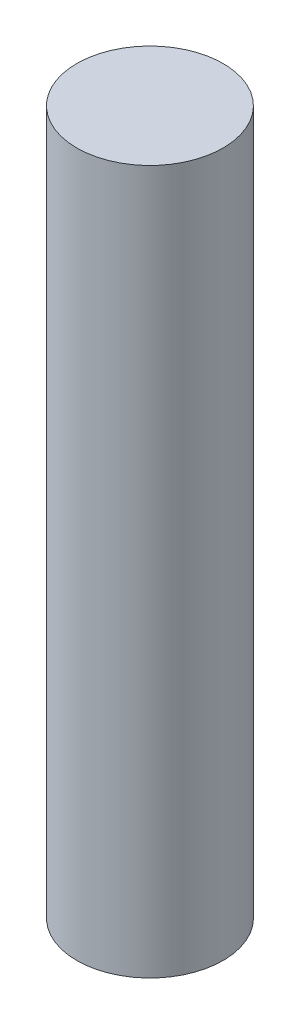
from build123d import *

# Parameters (mm, degrees)
SKETCH1_R           = 2.6
BOSS_EXTRUDE1_DEPTH = 25


with BuildPart() as part:
    # Sketch1 → Boss-Extrude1 (new body)
    with BuildSketch(Plane(origin=(0, 0, 0), x_dir=(1, 0, 0), z_dir=(0, 1, 0))):
        with Locations(Location((0, 0, 0), (0, 0, 270))):
            Circle(SKETCH1_R)
    extrude(amount=BOSS_EXTRUDE1_DEPTH)


solid = part.part
